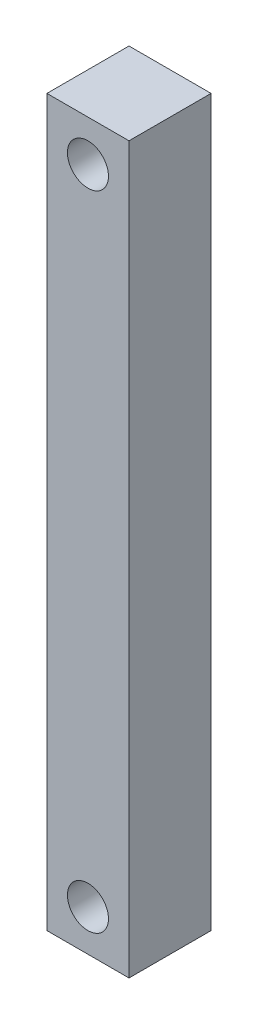
from build123d import *

# Parameters (mm, degrees)
SKETCH_1_W          = 6
SKETCH_1_H          = 53
EXTRUDE_1_DEPTH     = 6
SKETCH_2_R          = 1.5
CUT_EXTRUDE_1_DEPTH = 6


with BuildPart() as part:
    # 草图1 → 凸台-拉伸1 (new body)
    with BuildSketch(Plane.XY):
        Rectangle(SKETCH_1_W, SKETCH_1_H)
    extrude(amount=EXTRUDE_1_DEPTH)

    # 草图2 → 切除-拉伸1 (cut)
    with BuildSketch(Plane.XY.offset(6)):
        with Locations((0, 23.5)):
            Circle(SKETCH_2_R)
        with Locations(Location((0, -23.5, 0), (0, 0, 180))):
            Circle(SKETCH_2_R)
    extrude(amount=-CUT_EXTRUDE_1_DEPTH, mode=Mode.SUBTRACT)


solid = part.part
